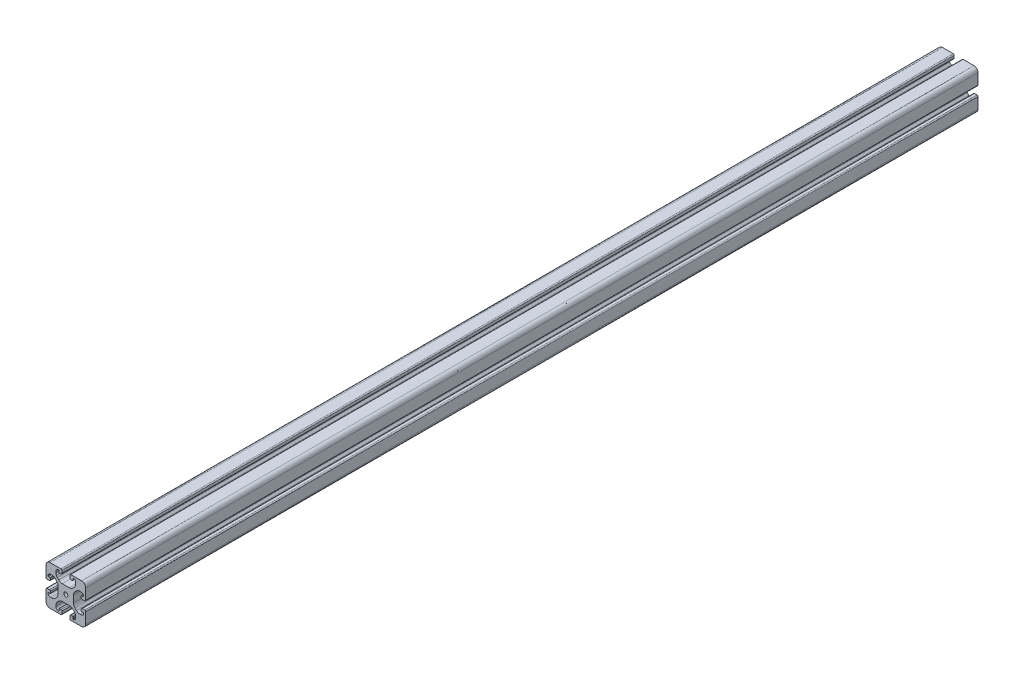
from build123d import *

# Parameters (mm, degrees)
EXTRUDE_3_DEPTH        = 900
HOLE_WIZARD_M5_1_D     = 4.2
HOLE_WIZARD_M5_1_DEPTH = 14
HOLE_WIZARD_M5_1_TIP   = 1.2618073
HOLE_WIZARD_M5_2_D     = 4.2
HOLE_WIZARD_M5_2_DEPTH = 14
HOLE_WIZARD_M5_2_TIP   = 1.2618073
HOLE_WIZARD_M5_3_D     = 4.2
HOLE_WIZARD_M5_4_D     = 4.2


with BuildPart() as part:
    # Model → 凸台-拉伸3 (new body)
    with BuildSketch(Plane.XY):
        with BuildLine():
            Line((3038.626047963, 1538.554851823), (3045.741173633, 1538.554851823))
            add(Edge.make_bspline(
                [(3049.276921118, 1537.0902465), (3048.8107636, 1537.556481082), (3047.704647958, 1538.266080891), (3046.441138301, 1538.554851823), (3045.741173633, 1538.554851823)],
                knots=[0, 0, 0, 0, 0.489373028, 1, 1, 1, 1], degree=3))
            Line((3049.276921118, 1537.0902465), (3050.719115205, 1535.647813992))
            add(Edge.make_bspline(
                [(3052.183720448, 1532.112305099), (3052.183720448, 1532.801572394), (3051.892347197, 1534.083862245), (3051.192575602, 1535.174275324), (3050.719115205, 1535.647813992)],
                knots=[0, 0, 0, 0, 0.510203542, 1, 1, 1, 1], degree=3))
            Line((3052.183720448, 1532.112305099), (3052.183720448, 1530.804817427))
            add(Edge.make_bspline(
                [(3049.683663262, 1528.304760288), (3050.380891253, 1528.304760288), (3051.623803853, 1528.908542343), (3052.183720448, 1530.04566751), (3052.183720448, 1530.804817427)],
                knots=[0, 0, 0, 0, 0.502793736, 1, 1, 1, 1], degree=3))
            Line((3049.683663262, 1528.304760288), (3049.633595356, 1528.304760288))
            add(Edge.make_bspline(
                [(3049.183699488, 1528.754894547), (3049.183699488, 1528.621135634), (3049.310613574, 1528.399867559), (3049.514098722, 1528.304760288), (3049.633595356, 1528.304760288)],
                knots=[0, 0, 0, 0, 0.549542039, 1, 1, 1, 1], degree=3))
            Line((3049.183699488, 1528.754894547), (3049.183699488, 1530.304853729))
            add(Edge.make_bspline(
                [(3048.683735721, 1530.80481748), (3048.814583007, 1530.80481748), (3049.063948712, 1530.68728955), (3049.183699488, 1530.463207638), (3049.183699488, 1530.304853729)],
                knots=[0, 0, 0, 0, 0.482405948, 1, 1, 1, 1], degree=3))
            Line((3048.683735721, 1530.80481748), (3047.183606011, 1530.80481748))
            add(Edge.make_bspline(
                [(3046.183678534, 1529.804889962), (3046.183678534, 1530.108777492), (3046.477620245, 1530.598884032), (3046.929836169, 1530.80481748), (3047.183606011, 1530.80481748)],
                knots=[0, 0, 0, 0, 0.565195279, 1, 1, 1, 1], degree=3))
            Line((3046.183678534, 1529.804889962), (3046.183678534, 1527.304832729))
            add(Edge.make_bspline(
                [(3047.183606089, 1526.304666828), (3046.967197552, 1526.304664508), (3046.468490599, 1526.522616874), (3046.183678534, 1526.949099653), (3046.183678534, 1527.304832729)],
                knots=[0, 0, 0, 0, 0.421049349, 1, 1, 1, 1], degree=3))
            Line((3047.183606089, 1526.304666828), (3058.183762491, 1526.304784773))
            add(Edge.make_bspline(
                [(3058.183762491, 1526.304784773), (3059.53269494, 1526.304799236), (3061.276507698, 1527.365293091), (3062.183710881, 1529.362340035), (3062.183710881, 1530.304971497)],
                knots=[0, 0, 0, 0, 0.550544017, 1, 1, 1, 1], degree=3))
            Line((3062.183710881, 1530.304971497), (3062.183710881, 1541.304889481))
            add(Edge.make_bspline(
                [(3062.183710881, 1541.304889481), (3062.183710881, 1541.642072865), (3061.918643232, 1542.0781123), (3061.419310763, 1542.304817095), (3061.183545011, 1542.304817095)],
                knots=[0, 0, 0, 0, 0.550414522, 1, 1, 1, 1], degree=3))
            Line((3061.183545011, 1542.304817095), (3058.683726198, 1542.304817095))
            add(Edge.make_bspline(
                [(3058.683726198, 1542.304817095), (3058.347819216, 1542.304817095), (3057.911122877, 1542.041298811), (3057.683560264, 1541.542079896), (3057.683560264, 1541.30488962)],
                knots=[0, 0, 0, 0, 0.548463708, 1, 1, 1, 1], degree=3))
            Line((3057.683560264, 1541.30488962), (3057.683560264, 1539.804759902))
            add(Edge.make_bspline(
                [(3057.683560264, 1539.804759902), (3057.683560264, 1539.638611723), (3057.813635543, 1539.41945383), (3058.063313821, 1539.304796137), (3058.18376242, 1539.304796137)],
                knots=[0, 0, 0, 0, 0.543007867, 1, 1, 1, 1], degree=3))
            Line((3058.18376242, 1539.304796137), (3059.733721607, 1539.304796137))
            add(Edge.make_bspline(
                [(3059.733721607, 1539.304796137), (3059.900592531, 1539.304796137), (3060.08944904, 1539.170214152), (3060.183617459, 1538.946084099), (3060.183617459, 1538.854900293)],
                knots=[0, 0, 0, 0, 0.601271686, 1, 1, 1, 1], degree=3))
            Line((3060.183617459, 1538.854900293), (3060.183617459, 1538.804832319))
            add(Edge.make_bspline(
                [(3060.183617459, 1538.804832319), (3060.183617459, 1537.972969288), (3059.533728376, 1536.87693448), (3058.285558814, 1536.304775171), (3057.683560223, 1536.304775171)],
                knots=[0, 0, 0, 0, 0.54350612, 1, 1, 1, 1], degree=3))
            Line((3057.683560223, 1536.304775171), (3056.376072735, 1536.304775171))
            add(Edge.make_bspline(
                [(3056.376072735, 1536.304775171), (3055.697422379, 1536.304775171), (3054.429528001, 1536.577546077), (3053.324285242, 1537.285658909), (3052.840563739, 1537.769380411)],
                knots=[0, 0, 0, 0, 0.495306505, 1, 1, 1, 1], degree=3))
            Line((3052.840563739, 1537.769380411), (3051.398131257, 1539.211812893))
            add(Edge.make_bspline(
                [(3051.398131257, 1539.211812893), (3050.933823015, 1539.676121135), (3050.239839391, 1540.76814585), (3049.933764339, 1542.050783071), (3049.933764339, 1542.747322003)],
                knots=[0, 0, 0, 0, 0.481772339, 1, 1, 1, 1], degree=3))
            Line((3049.933764339, 1542.747322003), (3049.933764339, 1549.862447649))
            add(Edge.make_bspline(
                [(3051.398131257, 1553.39795676), (3050.933823015, 1552.933648518), (3050.239839391, 1551.841623803), (3049.933764339, 1550.558986582), (3049.933764339, 1549.862447649)],
                knots=[0, 0, 0, 0, 0.481772339, 1, 1, 1, 1], degree=3))
            Line((3051.398131257, 1553.39795676), (3052.840563739, 1554.840389241))
            add(Edge.make_bspline(
                [(3056.376072735, 1556.304994482), (3055.697422379, 1556.304994482), (3054.429528001, 1556.032223576), (3053.324285242, 1555.324110744), (3052.840563739, 1554.840389241)],
                knots=[0, 0, 0, 0, 0.495306505, 1, 1, 1, 1], degree=3))
            Line((3056.376072735, 1556.304994482), (3057.683560223, 1556.304994482))
            add(Edge.make_bspline(
                [(3060.183617459, 1553.804937334), (3060.183617459, 1554.636800364), (3059.533728376, 1555.732835172), (3058.285558814, 1556.304994482), (3057.683560223, 1556.304994482)],
                knots=[0, 0, 0, 0, 0.54350612, 1, 1, 1, 1], degree=3))
            Line((3060.183617459, 1553.804937334), (3060.183617459, 1553.75486936))
            add(Edge.make_bspline(
                [(3059.733721607, 1553.304973516), (3059.900592531, 1553.304973516), (3060.08944904, 1553.4395555), (3060.183617459, 1553.663685553), (3060.183617459, 1553.75486936)],
                knots=[0, 0, 0, 0, 0.601271686, 1, 1, 1, 1], degree=3))
            Line((3059.733721607, 1553.304973516), (3058.18376242, 1553.304973516))
            add(Edge.make_bspline(
                [(3057.683560264, 1552.80500975), (3057.683560264, 1552.97115793), (3057.813635543, 1553.190315823), (3058.063313821, 1553.304973516), (3058.18376242, 1553.304973516)],
                knots=[0, 0, 0, 0, 0.543007867, 1, 1, 1, 1], degree=3))
            Line((3057.683560264, 1552.80500975), (3057.683560264, 1551.304880033))
            add(Edge.make_bspline(
                [(3058.683726198, 1550.304952558), (3058.347819216, 1550.304952558), (3057.911122877, 1550.568470841), (3057.683560264, 1551.067689757), (3057.683560264, 1551.304880033)],
                knots=[0, 0, 0, 0, 0.548463708, 1, 1, 1, 1], degree=3))
            Line((3058.683726198, 1550.304952558), (3061.183545011, 1550.304952558))
            add(Edge.make_bspline(
                [(3062.183710881, 1551.304880172), (3062.183710881, 1550.967696788), (3061.918643232, 1550.531657353), (3061.419310763, 1550.304952558), (3061.183545011, 1550.304952558)],
                knots=[0, 0, 0, 0, 0.550414522, 1, 1, 1, 1], degree=3))
            Line((3062.183710881, 1551.304880172), (3062.183710881, 1562.304798156))
            add(Edge.make_bspline(
                [(3058.183762491, 1566.30498488), (3059.53269494, 1566.304970416), (3061.276507698, 1565.244476562), (3062.183710881, 1563.247429618), (3062.183710881, 1562.304798156)],
                knots=[0, 0, 0, 0, 0.550544017, 1, 1, 1, 1], degree=3))
            Line((3058.183762491, 1566.30498488), (3047.183606089, 1566.305102825))
            add(Edge.make_bspline(
                [(3047.183606089, 1566.305102825), (3046.967197552, 1566.305105145), (3046.468490599, 1566.087152778), (3046.183678534, 1565.66067), (3046.183678534, 1565.304936924)],
                knots=[0, 0, 0, 0, 0.421049349, 1, 1, 1, 1], degree=3))
            Line((3046.183678534, 1565.304936924), (3046.183678534, 1562.804879691))
            add(Edge.make_bspline(
                [(3046.183678534, 1562.804879691), (3046.183678534, 1562.500992161), (3046.477620245, 1562.010885621), (3046.929836169, 1561.804952173), (3047.183606011, 1561.804952173)],
                knots=[0, 0, 0, 0, 0.565195279, 1, 1, 1, 1], degree=3))
            Line((3047.183606011, 1561.804952173), (3048.683735721, 1561.804952173))
            add(Edge.make_bspline(
                [(3048.683735721, 1561.804952173), (3048.814583007, 1561.804952173), (3049.063948712, 1561.922480103), (3049.183699488, 1562.146562015), (3049.183699488, 1562.304915923)],
                knots=[0, 0, 0, 0, 0.482405948, 1, 1, 1, 1], degree=3))
            Line((3049.183699488, 1562.304915923), (3049.183699488, 1563.854875106))
            add(Edge.make_bspline(
                [(3049.183699488, 1563.854875106), (3049.183699488, 1563.988634019), (3049.310613574, 1564.209902094), (3049.514098722, 1564.305009365), (3049.633595356, 1564.305009365)],
                knots=[0, 0, 0, 0, 0.549542039, 1, 1, 1, 1], degree=3))
            Line((3049.633595356, 1564.305009365), (3049.683663262, 1564.305009365))
            add(Edge.make_bspline(
                [(3049.683663262, 1564.305009365), (3050.380891253, 1564.305009365), (3051.623803853, 1563.70122731), (3052.183720448, 1562.564102142), (3052.183720448, 1561.804952226)],
                knots=[0, 0, 0, 0, 0.502793736, 1, 1, 1, 1], degree=3))
            Line((3052.183720448, 1561.804952226), (3052.183720448, 1560.497464554))
            add(Edge.make_bspline(
                [(3052.183720448, 1560.497464554), (3052.183720448, 1559.808197259), (3051.892347197, 1558.525907408), (3051.192575602, 1557.435494329), (3050.719115205, 1556.961955661)],
                knots=[0, 0, 0, 0, 0.510203542, 1, 1, 1, 1], degree=3))
            Line((3050.719115205, 1556.961955661), (3049.276921118, 1555.519523152))
            add(Edge.make_bspline(
                [(3049.276921118, 1555.519523152), (3048.8107636, 1555.05328857), (3047.704647958, 1554.343688762), (3046.441138301, 1554.05491783), (3045.741173633, 1554.05491783)],
                knots=[0, 0, 0, 0, 0.489373028, 1, 1, 1, 1], degree=3))
            Line((3045.741173633, 1554.05491783), (3038.626047963, 1554.05491783))
            add(Edge.make_bspline(
                [(3035.090300479, 1555.519523152), (3035.556457996, 1555.05328857), (3036.662573638, 1554.343688762), (3037.926083295, 1554.05491783), (3038.626047963, 1554.05491783)],
                knots=[0, 0, 0, 0, 0.489373028, 1, 1, 1, 1], degree=3))
            Line((3035.090300479, 1555.519523152), (3033.648106391, 1556.961955661))
            add(Edge.make_bspline(
                [(3032.183501148, 1560.497464554), (3032.183501148, 1559.808197259), (3032.474874399, 1558.525907408), (3033.174645994, 1557.435494329), (3033.648106391, 1556.961955661)],
                knots=[0, 0, 0, 0, 0.510203542, 1, 1, 1, 1], degree=3))
            Line((3032.183501148, 1560.497464554), (3032.183501148, 1561.804952226))
            add(Edge.make_bspline(
                [(3034.683558334, 1564.305009365), (3033.986330343, 1564.305009365), (3032.743417743, 1563.70122731), (3032.183501148, 1562.564102142), (3032.183501148, 1561.804952226)],
                knots=[0, 0, 0, 0, 0.502793736, 1, 1, 1, 1], degree=3))
            Line((3034.683558334, 1564.305009365), (3034.73362624, 1564.305009365))
            add(Edge.make_bspline(
                [(3035.183522108, 1563.854875106), (3035.183522108, 1563.988634019), (3035.056608022, 1564.209902094), (3034.853122874, 1564.305009365), (3034.73362624, 1564.305009365)],
                knots=[0, 0, 0, 0, 0.549542039, 1, 1, 1, 1], degree=3))
            Line((3035.183522108, 1563.854875106), (3035.183522108, 1562.304915923))
            add(Edge.make_bspline(
                [(3035.683485875, 1561.804952173), (3035.552638589, 1561.804952173), (3035.303272884, 1561.922480103), (3035.183522108, 1562.146562015), (3035.183522108, 1562.304915923)],
                knots=[0, 0, 0, 0, 0.482405948, 1, 1, 1, 1], degree=3))
            Line((3035.683485875, 1561.804952173), (3037.183615585, 1561.804952173))
            add(Edge.make_bspline(
                [(3038.183543062, 1562.804879691), (3038.183543062, 1562.500992161), (3037.889601351, 1562.010885621), (3037.437385427, 1561.804952173), (3037.183615585, 1561.804952173)],
                knots=[0, 0, 0, 0, 0.565195279, 1, 1, 1, 1], degree=3))
            Line((3038.183543062, 1562.804879691), (3038.183543062, 1565.304936924))
            add(Edge.make_bspline(
                [(3037.183615507, 1566.305102825), (3037.400024044, 1566.305105145), (3037.898730997, 1566.087152778), (3038.183543062, 1565.66067), (3038.183543062, 1565.304936924)],
                knots=[0, 0, 0, 0, 0.421049349, 1, 1, 1, 1], degree=3))
            Line((3037.183615507, 1566.305102825), (3026.183459105, 1566.30498488))
            add(Edge.make_bspline(
                [(3026.183459105, 1566.30498488), (3024.834526656, 1566.304970416), (3023.090713898, 1565.244476562), (3022.183510715, 1563.247429618), (3022.183510715, 1562.304798156)],
                knots=[0, 0, 0, 0, 0.550544017, 1, 1, 1, 1], degree=3))
            Line((3022.183510715, 1562.304798156), (3022.183510715, 1551.304880172))
            add(Edge.make_bspline(
                [(3022.183510715, 1551.304880172), (3022.183510715, 1550.967696788), (3022.448578364, 1550.531657353), (3022.947910833, 1550.304952558), (3023.183676585, 1550.304952558)],
                knots=[0, 0, 0, 0, 0.550414522, 1, 1, 1, 1], degree=3))
            Line((3023.183676585, 1550.304952558), (3025.683495398, 1550.304952558))
            add(Edge.make_bspline(
                [(3025.683495398, 1550.304952558), (3026.01940238, 1550.304952558), (3026.45609872, 1550.568470841), (3026.683661332, 1551.067689757), (3026.683661332, 1551.304880033)],
                knots=[0, 0, 0, 0, 0.548463708, 1, 1, 1, 1], degree=3))
            Line((3026.683661332, 1551.304880033), (3026.683661332, 1552.80500975))
            add(Edge.make_bspline(
                [(3026.683661332, 1552.80500975), (3026.683661332, 1552.97115793), (3026.553586053, 1553.190315823), (3026.303907775, 1553.304973516), (3026.183459176, 1553.304973516)],
                knots=[0, 0, 0, 0, 0.543007867, 1, 1, 1, 1], degree=3))
            Line((3026.183459176, 1553.304973516), (3024.633499989, 1553.304973516))
            add(Edge.make_bspline(
                [(3024.633499989, 1553.304973516), (3024.466629065, 1553.304973516), (3024.277772556, 1553.4395555), (3024.183604137, 1553.663685553), (3024.183604137, 1553.75486936)],
                knots=[0, 0, 0, 0, 0.601271686, 1, 1, 1, 1], degree=3))
            Line((3024.183604137, 1553.75486936), (3024.183604137, 1553.804937334))
            add(Edge.make_bspline(
                [(3024.183604137, 1553.804937334), (3024.183604137, 1554.636800364), (3024.833493221, 1555.732835172), (3026.081662782, 1556.304994482), (3026.683661373, 1556.304994482)],
                knots=[0, 0, 0, 0, 0.54350612, 1, 1, 1, 1], degree=3))
            Line((3026.683661373, 1556.304994482), (3027.991148861, 1556.304994482))
            add(Edge.make_bspline(
                [(3027.991148861, 1556.304994482), (3028.669799217, 1556.304994482), (3029.937693595, 1556.032223576), (3031.042936355, 1555.324110744), (3031.526657857, 1554.840389241)],
                knots=[0, 0, 0, 0, 0.495306505, 1, 1, 1, 1], degree=3))
            Line((3031.526657857, 1554.840389241), (3032.969090339, 1553.39795676))
            add(Edge.make_bspline(
                [(3032.969090339, 1553.39795676), (3033.433398581, 1552.933648518), (3034.127382205, 1551.841623803), (3034.433457257, 1550.558986582), (3034.433457257, 1549.862447649)],
                knots=[0, 0, 0, 0, 0.481772339, 1, 1, 1, 1], degree=3))
            Line((3034.433457257, 1549.862447649), (3034.433457257, 1542.747322003))
            add(Edge.make_bspline(
                [(3032.969090339, 1539.211812893), (3033.433398581, 1539.676121135), (3034.127382205, 1540.76814585), (3034.433457257, 1542.050783071), (3034.433457257, 1542.747322003)],
                knots=[0, 0, 0, 0, 0.481772339, 1, 1, 1, 1], degree=3))
            Line((3032.969090339, 1539.211812893), (3031.526657857, 1537.769380411))
            add(Edge.make_bspline(
                [(3027.991148861, 1536.304775171), (3028.669799217, 1536.304775171), (3029.937693595, 1536.577546077), (3031.042936355, 1537.285658909), (3031.526657857, 1537.769380411)],
                knots=[0, 0, 0, 0, 0.495306505, 1, 1, 1, 1], degree=3))
            Line((3027.991148861, 1536.304775171), (3026.683661373, 1536.304775171))
            add(Edge.make_bspline(
                [(3024.183604137, 1538.804832319), (3024.183604137, 1537.972969288), (3024.833493221, 1536.87693448), (3026.081662782, 1536.304775171), (3026.683661373, 1536.304775171)],
                knots=[0, 0, 0, 0, 0.54350612, 1, 1, 1, 1], degree=3))
            Line((3024.183604137, 1538.804832319), (3024.183604137, 1538.854900293))
            add(Edge.make_bspline(
                [(3024.633499989, 1539.304796137), (3024.466629065, 1539.304796137), (3024.277772556, 1539.170214152), (3024.183604137, 1538.946084099), (3024.183604137, 1538.854900293)],
                knots=[0, 0, 0, 0, 0.601271686, 1, 1, 1, 1], degree=3))
            Line((3024.633499989, 1539.304796137), (3026.183459176, 1539.304796137))
            add(Edge.make_bspline(
                [(3026.683661332, 1539.804759902), (3026.683661332, 1539.638611723), (3026.553586053, 1539.41945383), (3026.303907775, 1539.304796137), (3026.183459176, 1539.304796137)],
                knots=[0, 0, 0, 0, 0.543007867, 1, 1, 1, 1], degree=3))
            Line((3026.683661332, 1539.804759902), (3026.683661332, 1541.30488962))
            add(Edge.make_bspline(
                [(3025.683495398, 1542.304817095), (3026.01940238, 1542.304817095), (3026.45609872, 1542.041298811), (3026.683661332, 1541.542079896), (3026.683661332, 1541.30488962)],
                knots=[0, 0, 0, 0, 0.548463708, 1, 1, 1, 1], degree=3))
            Line((3025.683495398, 1542.304817095), (3023.183676585, 1542.304817095))
            add(Edge.make_bspline(
                [(3022.183510715, 1541.304889481), (3022.183510715, 1541.642072865), (3022.448578364, 1542.0781123), (3022.947910833, 1542.304817095), (3023.183676585, 1542.304817095)],
                knots=[0, 0, 0, 0, 0.550414522, 1, 1, 1, 1], degree=3))
            Line((3022.183510715, 1541.304889481), (3022.183510715, 1530.304971497))
            add(Edge.make_bspline(
                [(3026.183459105, 1526.304784773), (3024.834526656, 1526.304799236), (3023.090713898, 1527.365293091), (3022.183510715, 1529.362340035), (3022.183510715, 1530.304971497)],
                knots=[0, 0, 0, 0, 0.550544017, 1, 1, 1, 1], degree=3))
            Line((3026.183459105, 1526.304784773), (3037.183615507, 1526.304666828))
            add(Edge.make_bspline(
                [(3037.183615507, 1526.304666828), (3037.400024044, 1526.304664508), (3037.898730997, 1526.522616874), (3038.183543062, 1526.949099653), (3038.183543062, 1527.304832729)],
                knots=[0, 0, 0, 0, 0.421049349, 1, 1, 1, 1], degree=3))
            Line((3038.183543062, 1527.304832729), (3038.183543062, 1529.804889962))
            add(Edge.make_bspline(
                [(3038.183543062, 1529.804889962), (3038.183543062, 1530.108777492), (3037.889601351, 1530.598884032), (3037.437385427, 1530.80481748), (3037.183615585, 1530.80481748)],
                knots=[0, 0, 0, 0, 0.565195279, 1, 1, 1, 1], degree=3))
            Line((3037.183615585, 1530.80481748), (3035.683485875, 1530.80481748))
            add(Edge.make_bspline(
                [(3035.683485875, 1530.80481748), (3035.552638589, 1530.80481748), (3035.303272884, 1530.68728955), (3035.183522108, 1530.463207638), (3035.183522108, 1530.304853729)],
                knots=[0, 0, 0, 0, 0.482405948, 1, 1, 1, 1], degree=3))
            Line((3035.183522108, 1530.304853729), (3035.183522108, 1528.754894547))
            add(Edge.make_bspline(
                [(3035.183522108, 1528.754894547), (3035.183522108, 1528.621135634), (3035.056608022, 1528.399867559), (3034.853122874, 1528.304760288), (3034.73362624, 1528.304760288)],
                knots=[0, 0, 0, 0, 0.549542039, 1, 1, 1, 1], degree=3))
            Line((3034.73362624, 1528.304760288), (3034.683558334, 1528.304760288))
            add(Edge.make_bspline(
                [(3034.683558334, 1528.304760288), (3033.986330343, 1528.304760288), (3032.743417743, 1528.908542343), (3032.183501148, 1530.04566751), (3032.183501148, 1530.804817427)],
                knots=[0, 0, 0, 0, 0.502793736, 1, 1, 1, 1], degree=3))
            Line((3032.183501148, 1530.804817427), (3032.183501148, 1532.112305099))
            add(Edge.make_bspline(
                [(3032.183501148, 1532.112305099), (3032.183501148, 1532.801572394), (3032.474874399, 1534.083862245), (3033.174645994, 1535.174275324), (3033.648106391, 1535.647813992)],
                knots=[0, 0, 0, 0, 0.510203542, 1, 1, 1, 1], degree=3))
            Line((3033.648106391, 1535.647813992), (3035.090300479, 1537.0902465))
            add(Edge.make_bspline(
                [(3035.090300479, 1537.0902465), (3035.556457996, 1537.556481082), (3036.662573638, 1538.266080891), (3037.926083295, 1538.554851823), (3038.626047963, 1538.554851823)],
                knots=[0, 0, 0, 0, 0.489373028, 1, 1, 1, 1], degree=3))
        make_face()
    extrude(amount=EXTRUDE_3_DEPTH)

    # M5 螺纹孔1
    with Locations(Plane.XY.offset(900)):
        with Locations((3042.183610798, 1546.304884826)):
            Hole(HOLE_WIZARD_M5_1_D / 2, depth=HOLE_WIZARD_M5_1_DEPTH)
            with Locations((0, 0, -(HOLE_WIZARD_M5_1_DEPTH + HOLE_WIZARD_M5_1_TIP / 2))):  # 118° drill point
                Cone(0, HOLE_WIZARD_M5_1_D / 2, HOLE_WIZARD_M5_1_TIP, mode=Mode.SUBTRACT)

    # M5 螺纹孔2
    with Locations(Plane(origin=(0, 0, 0), x_dir=(-1, 0, 0), z_dir=(0, 0, -1))):
        with Locations((-3042.183610798, 1546.304884826)):
            Hole(HOLE_WIZARD_M5_2_D / 2, depth=HOLE_WIZARD_M5_2_DEPTH)
            with Locations((0, 0, -(HOLE_WIZARD_M5_2_DEPTH + HOLE_WIZARD_M5_2_TIP / 2))):  # 118° drill point
                Cone(0, HOLE_WIZARD_M5_2_D / 2, HOLE_WIZARD_M5_2_TIP, mode=Mode.SUBTRACT)

    # M5 螺纹孔3 (through all)
    with Locations(Plane(origin=(3049.933764339, 0, 0), x_dir=(0, 0, -1), z_dir=(1, 0, 0))):
        with Locations((-450, 1546.304884826)):
            Hole(HOLE_WIZARD_M5_3_D / 2)

    # M5 螺纹孔4 (through all)
    with Locations(Plane(origin=(0, 1554.05491783, 0), x_dir=(1, 0, 0), z_dir=(0, 1, 0))):
        with Locations((3042.183610798, -450)):
            Hole(HOLE_WIZARD_M5_4_D / 2)


solid = part.part
